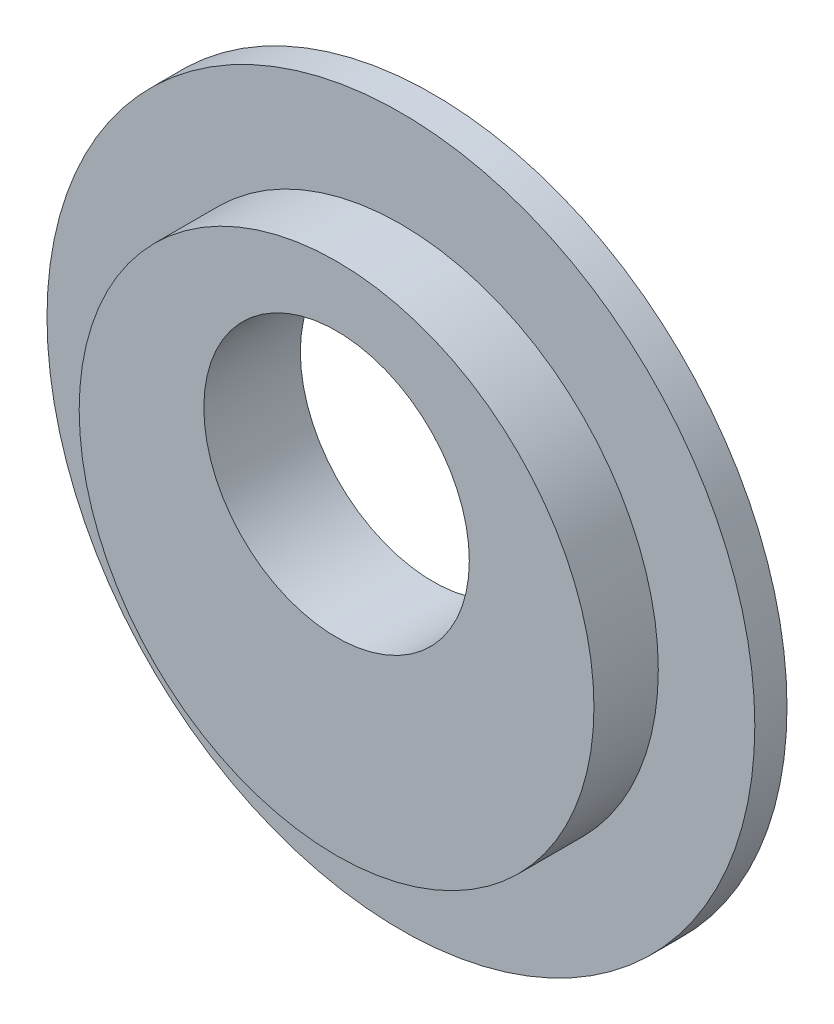
from build123d import *

# Parameters (mm, degrees)
SKETCH1_R           = 17.4625
SKETCH1_R_2         = 6.55
BOSS_EXTRUDE1_DEPTH = 1.5875
SKETCH4_R           = 12.7
SKETCH4_R_2         = 6.55
BOSS_EXTRUDE3_DEPTH = 3.175


with BuildPart() as part:
    # Sketch1 → Boss-Extrude1 (new body)
    with BuildSketch(Plane.XY):
        Circle(SKETCH1_R)
        with Locations((0, 3.175)):
            Circle(SKETCH1_R_2, mode=Mode.SUBTRACT)
    extrude(amount=BOSS_EXTRUDE1_DEPTH)

    # Sketch4 → Boss-Extrude3 (add)
    with BuildSketch(Plane.XY.offset(1.5875)):
        Circle(SKETCH4_R)
        with Locations((0, 3.175)):
            Circle(SKETCH4_R_2, mode=Mode.SUBTRACT)
    extrude(amount=BOSS_EXTRUDE3_DEPTH)


solid = part.part
